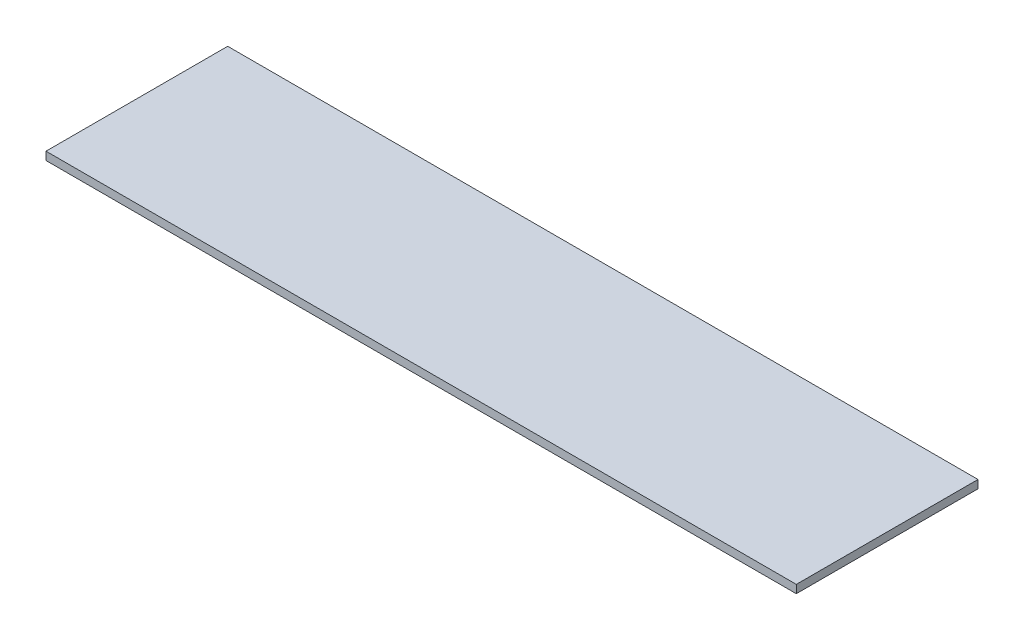
from build123d import *

# Parameters (mm, degrees)
SKETCH1_W           = 185
SKETCH1_H           = 44.8
BOSS_EXTRUDE1_DEPTH = 2


with BuildPart() as part:
    # Sketch1 → Boss-Extrude1 (new body)
    with BuildSketch(Plane(origin=(0, 0, 0), x_dir=(1, 0, 0), z_dir=(0, 1, 0))):
        Rectangle(SKETCH1_W, SKETCH1_H)
    extrude(amount=BOSS_EXTRUDE1_DEPTH)


solid = part.part
